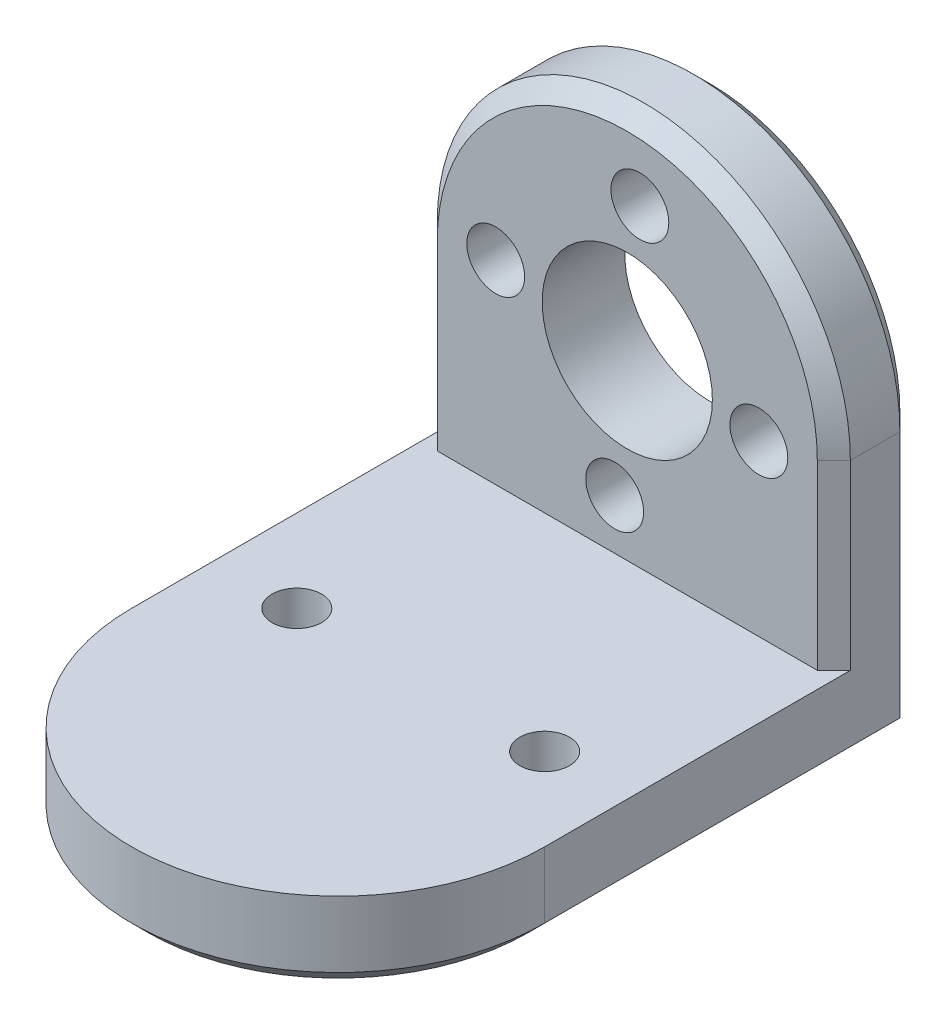
from build123d import *

# Parameters (mm, degrees)
ESQUISSE1_R             = 12.5
ESQUISSE1_R_2           = 5.15
BOSS_EXTRU_1_DEPTH      = 5
BOSS_EXTRU_2_DEPTH      = 5
ESQUISSE3_W             = 25
ESQUISSE3_H             = 5
BOSS_EXTRU_3_DEPTH      = 30
ESQUISSE5_R             = 1.75
ENL_V_MAT_EXTRU_1_DEPTH = 41.462946012
CONG_1_RADIUS           = 12.5
CONG_1_LENGTH           = 5
ESQUISSE6_R             = 1.5
ENL_V_MAT_EXTRU_2_DEPTH = 44.971581732
CHANFREIN1_SIZE         = 1
CHANFREIN2_SIZE         = 1


with BuildPart() as part:
    # Esquisse1 → Boss.-Extru.1 (new body)
    with BuildSketch(Plane.XY):
        Circle(ESQUISSE1_R)
        Circle(ESQUISSE1_R_2, mode=Mode.SUBTRACT)
    extrude(amount=BOSS_EXTRU_1_DEPTH)

    # Esquisse2 → Boss.-Extru.2 (add)
    with BuildSketch(Plane(origin=(0, 0, 0), x_dir=(-1, 0, 0), z_dir=(0, 0, -1))):
        with BuildLine():
            Line((-12.5, 0), (-12.5, -16))
            Line((-12.5, -16), (12.5, -16))
            Line((12.5, -16), (12.5, 0))
            ThreePointArc((12.5, 0), (0, -12.5), (-12.5, 0))
        make_face()
    extrude(amount=-BOSS_EXTRU_2_DEPTH)

    # Esquisse3 → Boss.-Extru.3 (add)
    with BuildSketch(Plane.XY.offset(5)):
        with Locations((0, -13.5)):
            Rectangle(ESQUISSE3_W, ESQUISSE3_H)
    extrude(amount=BOSS_EXTRU_3_DEPTH)

    # Esquisse5 → Enlèv. mat.-Extru.1 (cut, through all)
    with BuildSketch(Plane(origin=(0, 0, 0), x_dir=(-1, 0, 0), z_dir=(0, 0, -1))):
        with Locations((-0.762684291, 7.963561557)):
            Circle(ESQUISSE5_R)
        with Locations((-7.963561557, -0.762684291)):
            Circle(ESQUISSE5_R)
        with Locations((7.963561557, 0.762684291)):
            Circle(ESQUISSE5_R)
        with Locations((0.762684291, -7.963561557)):
            Circle(ESQUISSE5_R)
    extrude(amount=-ENL_V_MAT_EXTRU_1_DEPTH, mode=Mode.SUBTRACT)

    # Congé1: full round fillet: the end face becomes a half cylinder, R = half its width
    cong_1_face = Plane((0, -13.5, 35), x_dir=(0, -1, 0), z_dir=(0, 0, 1))  # on the end face: x along it, z out of the body
    cong_1_slab = cong_1_face.offset(-CONG_1_RADIUS / 2) * Box(CONG_1_LENGTH, 2 * CONG_1_RADIUS, CONG_1_RADIUS, mode=Mode.PRIVATE)  # the body's end, R deep
    cong_1_round = Plane((0, -13.5, 22.5), x_dir=(0, 0, 1), z_dir=(0, -1, 0)) * Cylinder(CONG_1_RADIUS, CONG_1_LENGTH, mode=Mode.PRIVATE)  # its axis R under the face
    add(cong_1_slab - cong_1_round, mode=Mode.SUBTRACT)

    # Esquisse6 → Enlèv. mat.-Extru.2 (cut, through all)
    with BuildSketch(Plane(origin=(0, -11, 0), x_dir=(1, 0, 0), z_dir=(0, 1, 0))):
        with Locations(Location((-7.5, -17.5, 0), (0, 0, 270))):
            Circle(ESQUISSE6_R)
        with Locations(Location((7.5, -17.5, 0), (0, 0, 90))):
            Circle(ESQUISSE6_R)
    extrude(amount=-ENL_V_MAT_EXTRU_2_DEPTH, mode=Mode.SUBTRACT)

    # Chanfrein1
    chanfrein1_edges = [part.edges().sort_by_distance(p)[0] for p in [
        (12.5, -5.5, 5),
        (-12.5, -5.5, 5),
        (0, 12.5, 5),
    ]]
    chamfer(chanfrein1_edges, length=CHANFREIN1_SIZE)

    # Chanfrein2
    chanfrein2_edges = [part.edges().sort_by_distance(p)[0] for p in [
        (12.5, -8, 0),
        (-12.5, -8, 0),
        (0, 12.5, 0),
        (-12.5, -16, 11.25),
        (12.5, -16, 11.25),
        (0, -16, 35),
    ]]
    chamfer(chanfrein2_edges, length=CHANFREIN2_SIZE)


solid = part.part
